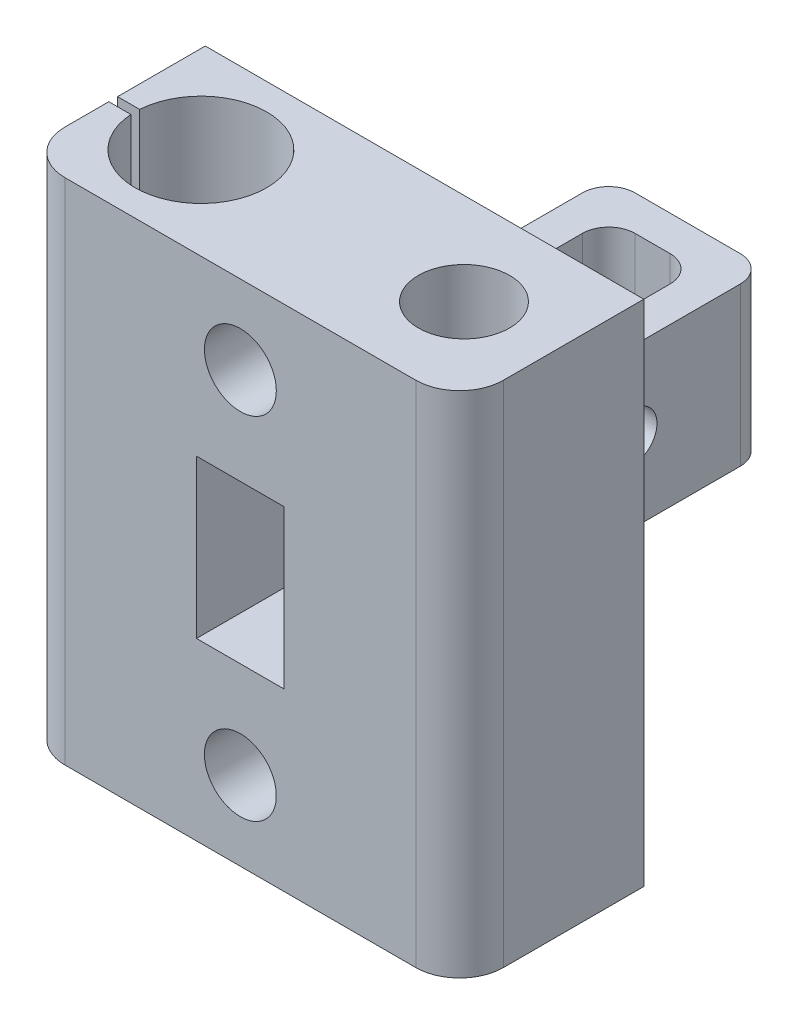
from build123d import *

# Parameters (mm, degrees)
SKETCH1_W           = 50
SKETCH1_H           = 21
BOSS_EXTRUDE1_DEPTH = 58
SKETCH3_R           = 7.5
CUT_EXTRUDE1_DEPTH  = 24
CUT_EXTRUDE2_REACH  = 66.025
SKETCH4_R           = 5.2
CUT_EXTRUDE3_START  = -24
SKETCH5_R           = 7.5
CUT_EXTRUDE3_DEPTH  = 24
CUT_EXTRUDE4_REACH  = 66.025
SKETCH6_R           = 4.5
CUT_EXTRUDE5_REACH  = 68.558
SKETCH8_W           = 10
SKETCH8_H           = 18
SKETCH7_R           = 4.1
CUT_EXTRUDE6_DEPTH  = 15
SKETCH11_W          = 4
SKETCH11_H          = 18
BOSS_EXTRUDE2_DEPTH = 26
SKETCH12_W          = 18
SKETCH12_H          = 18
BOSS_EXTRUDE3_DEPTH = 4
CUT_EXTRUDE7_DEPTH  = 79.487260113
FILLET1_R           = 5
FILLET2_R           = 5
FILLET3_R           = 3
SKETCH14_R          = 1.95
CUT_EXTRUDE8_DEPTH  = 10
SKETCH15_W          = 5.527864045
SKETCH15_H          = 1
CUT_EXTRUDE9_DEPTH  = 76.028327984


with BuildPart() as part:
    # Sketch1 → Boss-Extrude1 (new body)
    with BuildSketch(Plane(origin=(0, 0, 0), x_dir=(1, 0, 0), z_dir=(0, 1, 0))):
        Rectangle(SKETCH1_W, SKETCH1_H)
    extrude(amount=BOSS_EXTRUDE1_DEPTH)

    # Sketch3 → Cut-Extrude1 (cut)
    with BuildSketch(Plane(origin=(0, 58, 0), x_dir=(1, 0, 0), z_dir=(0, 1, 0))):
        with Locations(Location((-15, 0, 0), (0, 0, 270))):
            Circle(SKETCH3_R)
    extrude(amount=-CUT_EXTRUDE1_DEPTH, mode=Mode.SUBTRACT)

    # Sketch4 → Cut-Extrude2 (cut, up to next)
    with BuildSketch(Plane(origin=(0, 58, 0), x_dir=(1, 0, 0), z_dir=(0, 1, 0)), mode=Mode.PRIVATE) as cut_extrude2_sk1:
        with Locations(Location((15, 0, 0), (0, 0, 270))):
            Circle(SKETCH4_R)
    cut_extrude2_tool1 = extrude(cut_extrude2_sk1.sketch, amount=-CUT_EXTRUDE2_REACH, mode=Mode.PRIVATE) & part.part
    add(cut_extrude2_tool1.solids().sort_by_distance((15, 58, 0))[0], mode=Mode.SUBTRACT)

    # Sketch5 → Cut-Extrude3 (cut)
    with BuildSketch(Plane.XZ.offset(CUT_EXTRUDE3_START)):
        with Locations(Location((-15, 0, 0), (0, 0, 90))):
            Circle(SKETCH5_R)
    extrude(amount=CUT_EXTRUDE3_DEPTH, mode=Mode.SUBTRACT)

    # Sketch6 → Cut-Extrude4 (cut, up to next)
    with BuildSketch(Plane.XZ, mode=Mode.PRIVATE) as cut_extrude4_sk1:
        with Locations(Location((-15, 0, 0), (0, 0, 270))):
            Circle(SKETCH6_R)
    cut_extrude4_tool1 = extrude(cut_extrude4_sk1.sketch, amount=-CUT_EXTRUDE4_REACH, mode=Mode.PRIVATE) & part.part
    add(cut_extrude4_tool1.solids().sort_by_distance((-15, 0, 0))[0], mode=Mode.SUBTRACT)

    # Sketch8 → Cut-Extrude5 (cut, up to next)
    with BuildSketch(Plane.XY.offset(10.5), mode=Mode.PRIVATE) as cut_extrude5_sk1:
        with Locations((0, 29)):
            Rectangle(SKETCH8_W, SKETCH8_H)
    cut_extrude5_tool1 = extrude(cut_extrude5_sk1.sketch, amount=-CUT_EXTRUDE5_REACH, mode=Mode.PRIVATE) & part.part
    add(cut_extrude5_tool1.solids().sort_by_distance((0, 29, 10.5))[0], mode=Mode.SUBTRACT)

    # Sketch7 → Cut-Extrude6 (cut)
    with BuildSketch(Plane.XY.offset(10.5)):
        with Locations((0, 49)):
            Circle(SKETCH7_R)
        with Locations(Location((0, 9, 0), (0, 0, 180))):
            Circle(SKETCH7_R)
    extrude(amount=-CUT_EXTRUDE6_DEPTH, mode=Mode.SUBTRACT)

    # Sketch11 → Boss-Extrude2 (add)
    with BuildSketch(Plane(origin=(0, 0, -10.5), x_dir=(-1, 0, 0), z_dir=(0, 0, -1))):
        with Locations((7, 29)):
            Rectangle(SKETCH11_W, SKETCH11_H)
        with Locations((-7, 29)):
            Rectangle(SKETCH11_W, SKETCH11_H)
    extrude(amount=BOSS_EXTRUDE2_DEPTH)

    # Sketch12 → Boss-Extrude3 (add)
    with BuildSketch(Plane(origin=(0, 0, -36.5), x_dir=(-1, 0, 0), z_dir=(0, 0, -1))):
        with Locations((0, 29)):
            Rectangle(SKETCH12_W, SKETCH12_H)
    extrude(amount=BOSS_EXTRUDE3_DEPTH)

    # Sketch13 → Cut-Extrude7 (cut, through all)
    with BuildSketch(Plane(origin=(9, 0, 0), x_dir=(0, 0, -1), z_dir=(1, 0, 0))):
        with BuildLine():
            Line((16.25, 31.75), (25.25, 31.75))
            ThreePointArc((25.25, 31.75), (28, 29), (25.25, 26.25))
            Line((25.25, 26.25), (16.25, 26.25))
            ThreePointArc((16.25, 26.25), (13.5, 29), (16.25, 31.75))
        make_face()
    extrude(amount=-CUT_EXTRUDE7_DEPTH, mode=Mode.SUBTRACT)

    # Fillet1
    fillet1_edges = [part.edges().sort_by_distance(p)[0] for p in [
        (25, 29, 10.5),
        (-25, 29, 10.5),
    ]]
    fillet(fillet1_edges, radius=FILLET1_R)

    # Fillet2
    fillet2_edges = [part.edges().sort_by_distance(p)[0] for p in [
        (-7, 38, -10.5),
        (-7, 20, -10.5),
        (7, 20, -10.5),
        (7, 38, -10.5),
    ]]
    fillet(fillet2_edges, radius=FILLET2_R)

    # Fillet3
    fillet3_edges = [part.edges().sort_by_distance(p)[0] for p in [
        (-5, 29, -36.5),
        (5, 29, -36.5),
        (-9, 29, -40.5),
        (9, 29, -40.5),
    ]]
    fillet(fillet3_edges, radius=FILLET3_R)

    # Sketch14 → Cut-Extrude8 (cut)
    with BuildSketch(Plane.XZ):
        with Locations(Location((20.550788232, 5.550788232, 0), (0, 0, 270))):
            Circle(SKETCH14_R)
        with Locations(Location((9.449211768, -5.550788232, 0), (0, 0, 270))):
            Circle(SKETCH14_R)
    extrude(amount=-CUT_EXTRUDE8_DEPTH, mode=Mode.SUBTRACT)

    # Sketch15 → Cut-Extrude9 (cut, through all)
    with BuildSketch(Plane(origin=(0, 58, 0), x_dir=(1, 0, 0), z_dir=(0, 1, 0))):
        with Locations((-22.236067977, 0)):
            Rectangle(SKETCH15_W, SKETCH15_H)
    extrude(amount=-CUT_EXTRUDE9_DEPTH, mode=Mode.SUBTRACT)


solid = part.part
